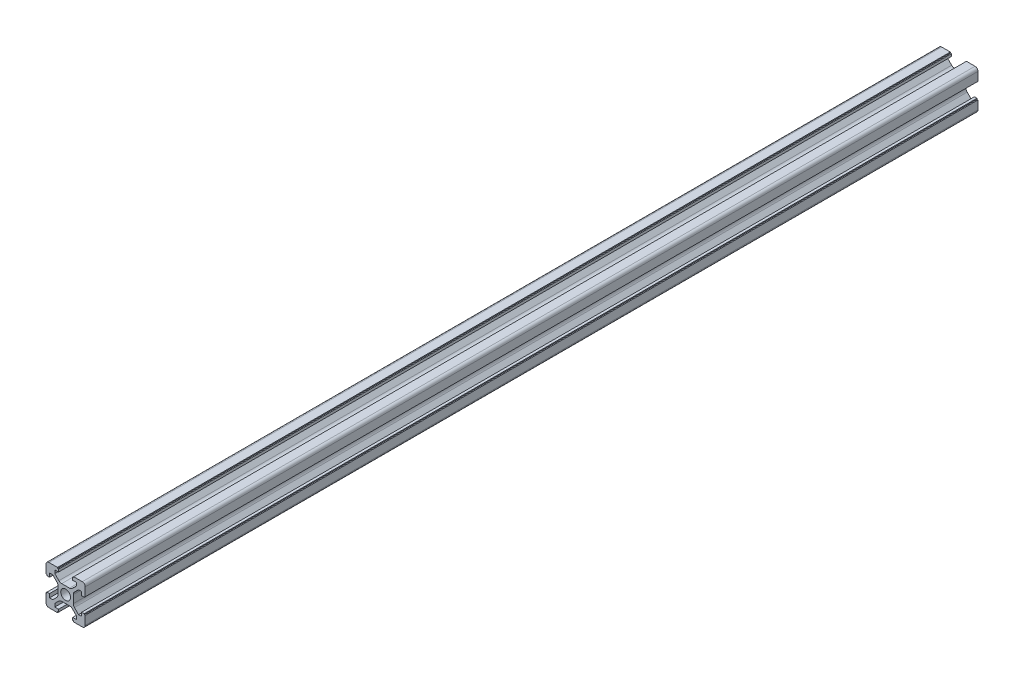
from build123d import *

# Parameters (mm, degrees)
SKETCH1_R           = 2.5
BOSS_EXTRUDE2_DEPTH = 455


with BuildPart() as part:
    # Sketch1 → Boss-Extrude2 (new body)
    with BuildSketch(Plane.XY):
        with BuildLine():
            Line((10, -4.1), (10, -8.5))
            ThreePointArc((10, -8.5), (9.560660172, -9.560660172), (8.5, -10))
            Line((8.5, -10), (4.1, -10))
            Line((4.1, -10), (4.1, -9.5))
            Line((4.1, -9.5), (3.6, -9.5))
            Line((3.6, -9.5), (3.6, -8.2))
            Line((3.6, -8.2), (5.5, -8.2))
            Line((5.5, -8.2), (5.5, -6.560660172))
            Line((5.5, -6.560660172), (3.425126266, -4.485786438))
            ThreePointArc((3.425126266, -4.485786438), (2.776279568, -4.052240935), (2.010912703, -3.9))
            Line((2.010912703, -3.9), (-2.010912703, -3.9))
            ThreePointArc((-2.010912703, -3.9), (-2.776279568, -4.052240935), (-3.425126266, -4.485786438))
            Line((-3.425126266, -4.485786438), (-5.5, -6.560660172))
            Line((-5.5, -6.560660172), (-5.5, -8.2))
            Line((-5.5, -8.2), (-3.6, -8.2))
            Line((-3.6, -8.2), (-3.6, -9.5))
            Line((-3.6, -9.5), (-4.1, -9.5))
            Line((-4.1, -9.5), (-4.1, -10))
            Line((-4.1, -10), (-8.5, -10))
            ThreePointArc((-8.5, -10), (-9.560660172, -9.560660172), (-10, -8.5))
            Line((-10, -8.5), (-10, -4.1))
            Line((-10, -4.1), (-9.5, -4.1))
            Line((-9.5, -4.1), (-9.5, -3.6))
            Line((-9.5, -3.6), (-8.2, -3.6))
            Line((-8.2, -3.6), (-8.2, -5.5))
            Line((-8.2, -5.5), (-6.560660172, -5.5))
            Line((-6.560660172, -5.5), (-4.485786438, -3.425126266))
            ThreePointArc((-4.485786438, -3.425126266), (-4.052240935, -2.776279568), (-3.9, -2.010912703))
            Line((-3.9, -2.010912703), (-3.9, 2.010912703))
            ThreePointArc((-3.9, 2.010912703), (-4.052240935, 2.776279568), (-4.485786438, 3.425126266))
            Line((-4.485786438, 3.425126266), (-6.560660172, 5.5))
            Line((-6.560660172, 5.5), (-8.2, 5.5))
            Line((-8.2, 5.5), (-8.2, 3.6))
            Line((-8.2, 3.6), (-9.5, 3.6))
            Line((-9.5, 3.6), (-9.5, 4.1))
            Line((-9.5, 4.1), (-10, 4.1))
            Line((-10, 4.1), (-10, 8.5))
            ThreePointArc((-10, 8.5), (-9.560660172, 9.560660172), (-8.5, 10))
            Line((-8.5, 10), (-4.1, 10))
            Line((-4.1, 10), (-4.1, 9.5))
            Line((-4.1, 9.5), (-3.6, 9.5))
            Line((-3.6, 9.5), (-3.6, 8.2))
            Line((-3.6, 8.2), (-5.5, 8.2))
            Line((-5.5, 8.2), (-5.5, 6.560660172))
            Line((-5.5, 6.560660172), (-3.425126266, 4.485786438))
            ThreePointArc((-3.425126266, 4.485786438), (-2.776279568, 4.052240935), (-2.010912703, 3.9))
            Line((-2.010912703, 3.9), (2.010912703, 3.9))
            ThreePointArc((2.010912703, 3.9), (2.776279568, 4.052240935), (3.425126266, 4.485786438))
            Line((3.425126266, 4.485786438), (5.5, 6.560660172))
            Line((5.5, 6.560660172), (5.5, 8.2))
            Line((5.5, 8.2), (3.6, 8.2))
            Line((3.6, 8.2), (3.6, 9.5))
            Line((3.6, 9.5), (4.1, 9.5))
            Line((4.1, 9.5), (4.1, 10))
            Line((4.1, 10), (8.5, 10))
            ThreePointArc((8.5, 10), (9.560660172, 9.560660172), (10, 8.5))
            Line((10, 8.5), (10, 4.1))
            Line((10, 4.1), (9.5, 4.1))
            Line((9.5, 4.1), (9.5, 3.6))
            Line((9.5, 3.6), (8.2, 3.6))
            Line((8.2, 3.6), (8.2, 5.5))
            Line((8.2, 5.5), (6.560660172, 5.5))
            Line((6.560660172, 5.5), (4.485786438, 3.425126266))
            ThreePointArc((4.485786438, 3.425126266), (4.052240935, 2.776279568), (3.9, 2.010912703))
            Line((3.9, 2.010912703), (3.9, -2.010912703))
            ThreePointArc((3.9, -2.010912703), (4.052240935, -2.776279568), (4.485786438, -3.425126266))
            Line((4.485786438, -3.425126266), (6.560660172, -5.5))
            Line((6.560660172, -5.5), (8.2, -5.5))
            Line((8.2, -5.5), (8.2, -3.6))
            Line((8.2, -3.6), (9.5, -3.6))
            Line((9.5, -3.6), (9.5, -4.1))
            Line((9.5, -4.1), (10, -4.1))
        make_face()
        with Locations(Location((0, 0, 0), (0, 0, 180))):
            Circle(SKETCH1_R, mode=Mode.SUBTRACT)
    extrude(amount=BOSS_EXTRUDE2_DEPTH)


solid = part.part
